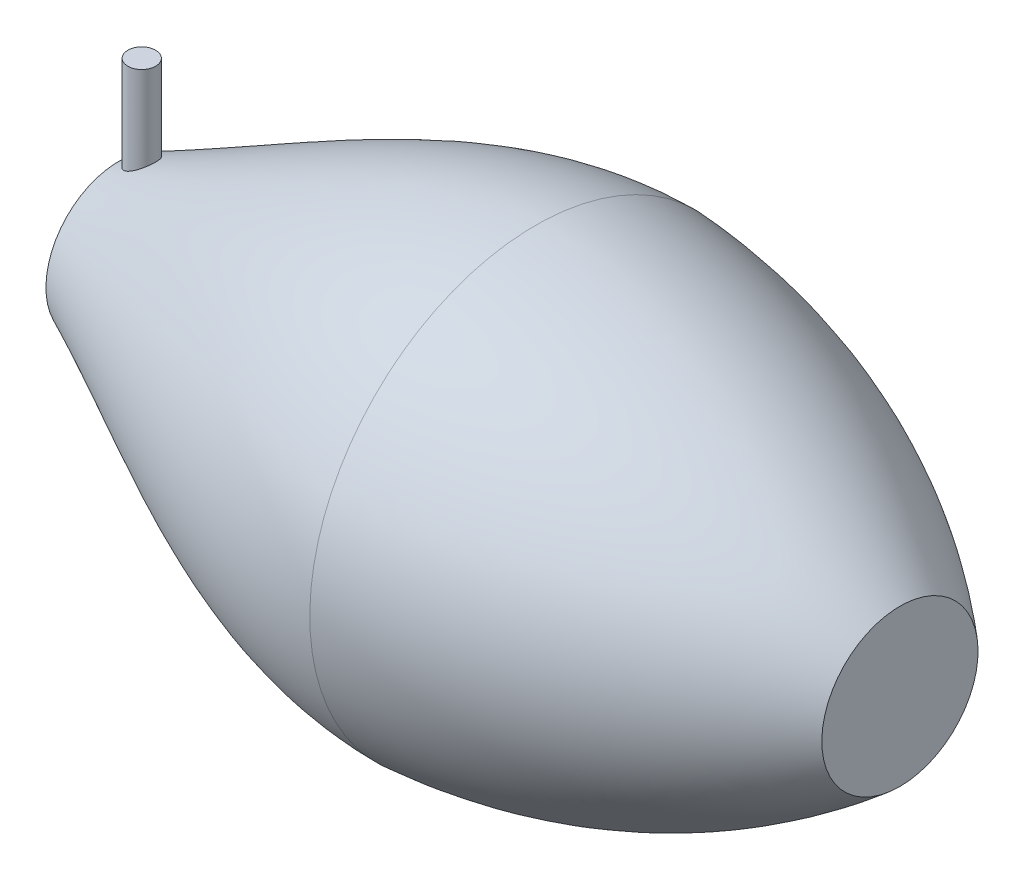
from build123d import *

# Parameters (mm, degrees)
SKETCH2_R           = 4
BOSS_EXTRUDE1_DEPTH = 50


with BuildPart() as part:
    # Sketch1 → Revolve1 (revolve)
    with BuildSketch(Plane.XY):
        with BuildLine():
            Line((105, 22.5), (105, 0))
            Line((105, 0), (-120, 0))
            Line((-120, 0), (-120, 21))
            add(Edge.make_bspline(
                [(-120, 21), (-81.316635244, 38.863480829), (-44.636693972, 64.575162418), (0, 65)],
                knots=[0, 0, 0, 0, 1, 1, 1, 1], degree=3))
            add(Edge.make_bspline(
                [(0, 65), (59.093222662, 61.077775604), (105, 22.5)],
                knots=[0, 0, 0, 1, 1, 1], degree=2))
        make_face()
    revolve(axis=Axis((-120, 0, 0), (1, 0, 0)))

    # Sketch2 → Boss-Extrude1 (add)
    with BuildSketch(Plane(origin=(0, 0, 0), x_dir=(1, 0, 0), z_dir=(0, 1, 0))):
        with Locations((-113.41069221, 0)):
            Circle(SKETCH2_R)
    extrude(amount=BOSS_EXTRUDE1_DEPTH)


solid = part.part
